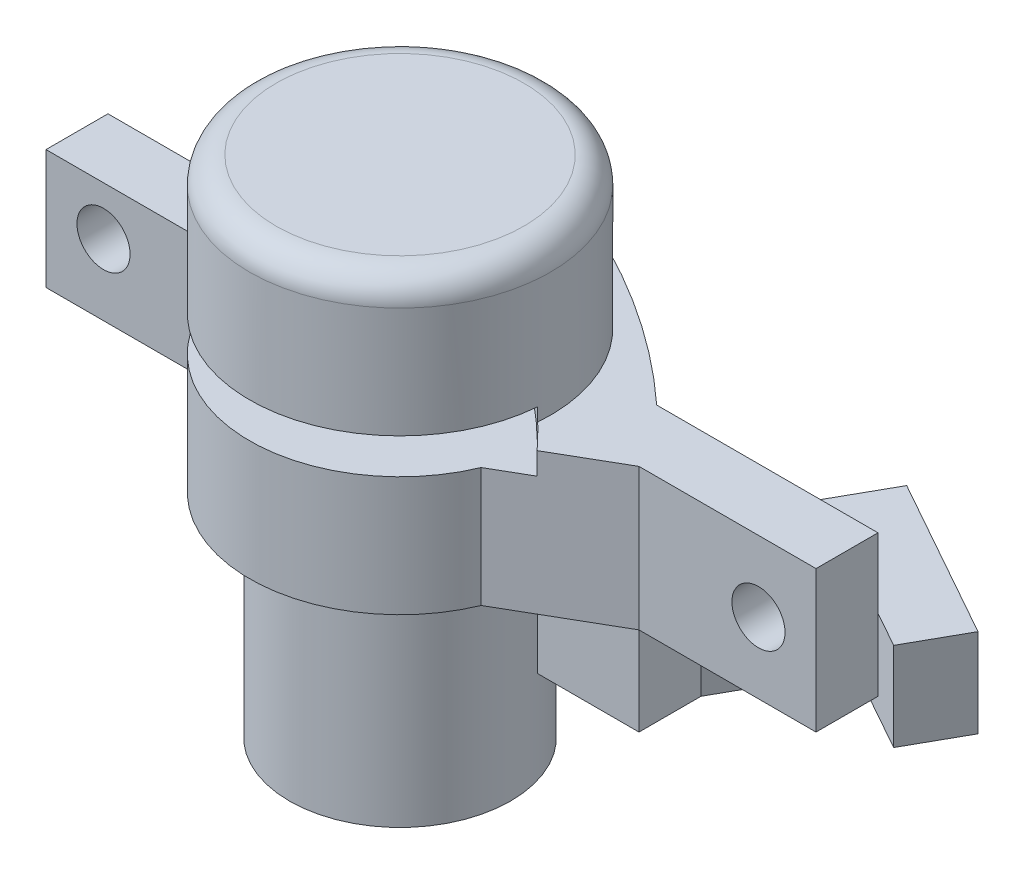
from build123d import *

# Parameters (mm, degrees)
BOSS_EXTRUDE1_DEPTH = 16
SKETCH2_R           = 17
BOSS_EXTRUDE2_DEPTH = 17
SKETCH3_R           = 12.5
BOSS_EXTRUDE3_DEPTH = 24
SKETCH4_R           = 3
CUT_EXTRUDE1_DEPTH  = 97.093704268
BOSS_EXTRUDE5_DEPTH = 10
SKETCH7_R           = 82
CUT_EXTRUDE2_DEPTH  = 4
FILLET1_R           = 3


with BuildPart() as part:
    # Sketch1 → Boss-Extrude1 (new body)
    with BuildSketch(Plane(origin=(0, 0, 0), x_dir=(1, 0, 0), z_dir=(0, 1, 0))):
        with BuildLine():
            Line((0, 0), (23, 0))
            ThreePointArc((23, 0), (36.672989813, -16.671262796), (55.697765084, -6.525348371))
            Line((55.697765084, -6.525348371), (67, 0))
            Line((67, 0), (87, 0))
            Line((87, 0), (87, 7))
            Line((87, 7), (62, 7))
            ThreePointArc((62, 7), (45.688374241, 18.635635799), (26.997081597, 25.853165477))
            ThreePointArc((26.997081597, 25.853165477), (22.544359958, 24.799758331), (20.813284408, 20.564221286))
            Line((20.813284408, 20.564221286), (22, 7))
            Line((22, 7), (0, 7))
            Line((0, 7), (0, 0))
        make_face()
    extrude(amount=BOSS_EXTRUDE1_DEPTH)

    # Sketch2 → Boss-Extrude2 (add)
    with BuildSketch(Plane(origin=(0, 16, 0), x_dir=(1, 0, 0), z_dir=(0, 1, 0))):
        with Locations(Location((40, 0, 0), (0, 0, 116.765541629))):
            Circle(SKETCH2_R)
    extrude(amount=BOSS_EXTRUDE2_DEPTH)

    # Sketch3 → Boss-Extrude3 (add)
    with BuildSketch(Plane.XZ):
        with Locations(Location((40, 0, 0), (0, 0, 270))):
            Circle(SKETCH3_R)
    extrude(amount=BOSS_EXTRUDE3_DEPTH)

    # Sketch4 → Cut-Extrude1 (cut, through all)
    with BuildSketch(Plane(origin=(0, 0, -7), x_dir=(-1, 0, 0), z_dir=(0, 0, -1))):
        with Locations((-80.5, 8)):
            Circle(SKETCH4_R)
        with Locations((-6.5, 8)):
            Circle(SKETCH4_R)
    extrude(amount=-CUT_EXTRUDE1_DEPTH, mode=Mode.SUBTRACT)

    # Sketch5 → Boss-Extrude5 (add)
    with BuildSketch(Plane(origin=(0, 0, 0), x_dir=(1, 0, 0), z_dir=(0, 1, 0))):
        Polygon((67, 7), (73.302829045, 18.25023255), (82.899413644, 12.873843052), (86.320752416, 18.980760523), (68, 29.244776839), (55.512272379, 6.954811689), (55.512272379, 0), (67, 0), align=None)
    extrude(amount=-BOSS_EXTRUDE5_DEPTH)

    # Sketch7 → Cut-Extrude2 (cut)
    with BuildSketch(Plane(origin=(0, 13.5, 0), x_dir=(1, 0, 0), z_dir=(0, 1, 0))):
        with Locations((-0.4, -60)):
            Circle(SKETCH7_R)
    extrude(amount=CUT_EXTRUDE2_DEPTH, mode=Mode.SUBTRACT)

    # Fillet1
    fillet1_edges = [part.edges().sort_by_distance(p)[0] for p in [
        (47.655791005, 33, 15.178565943),
    ]]
    fillet(fillet1_edges, radius=FILLET1_R)


solid = part.part
